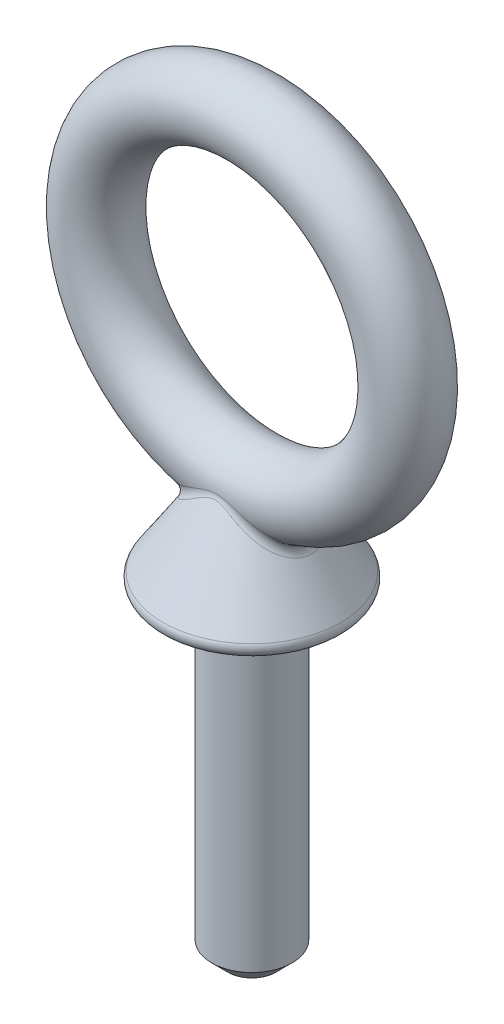
from build123d import *
from build123d.topology import SkipClean

# Parameters (mm, degrees)
BOSS_EXTRUDE1_START = -19.84375
SKETCH2_R           = 3.175
BOSS_EXTRUDE1_DEPTH = 25.4
SKETCH6_R           = 2.778125
SKETCH7_R           = 3.175
BOSS_EXTRUDE2_DEPTH = 4.7625
FILLET1_R           = 0.69453125
CHAMFER1_SIZE       = 1.27


with BuildPart() as part:
    # Sketch2 → Boss-Extrude1 (new body)
    with BuildSketch(Plane(origin=(0, 0, 0), x_dir=(1, 0, 0), z_dir=(0, 1, 0)).offset(BOSS_EXTRUDE1_START)):
        with Locations(Location((0, 0, 0), (0, 0, 270))):
            Circle(SKETCH2_R)
    extrude(amount=-BOSS_EXTRUDE1_DEPTH)

    # Sketch7 → Boss-Extrude2 (add)
    with BuildSketch(Plane(origin=(0, -19.84375, 0), x_dir=(1, 0, 0), z_dir=(0, 1, 0))):
        with Locations(Location((0, 0, 0), (0, 0, 270))):
            Circle(SKETCH7_R)
    extrude(amount=BOSS_EXTRUDE2_DEPTH)



with BuildPart() as body_2:
    # Sketch6 → Revolve1 (revolve)
    with BuildSketch(Plane(origin=(0, 0, 0), x_dir=(0, 0, -1), z_dir=(1, 0, 0)), mode=Mode.PRIVATE) as revolve1_sk:
        with Locations((0, 12.303125)):
            Circle(SKETCH6_R)
    revolve(revolve1_sk.sketch.rotate(Axis((0, 0, -7.858125), (0, 0, 1)), 90), axis=Axis((0, 0, -7.858125), (0, 0, 1)))


with BuildPart() as part_1:
    with SkipClean():  # the faces are left unmerged after this step: merging them gives an invalid solid
        add(part.part)

        add(body_2.part)  # Revolve2 merges body 2
        # Sketch8 → Revolve2 (revolve)
        with BuildSketch(Plane.XY, mode=Mode.PRIVATE) as revolve2_sk:
            with BuildLine():
                Line((0, -19.84375), (0, -12.303125))
                Line((0, -12.303125), (-2.778125, -12.303125))
                Line((-2.778125, -12.303125), (-7.029506171, -18.767590441))
                ThreePointArc((-7.029506171, -18.767590441), (-7.060539633, -19.478855573), (-6.44921875, -19.84375))
                Line((-6.44921875, -19.84375), (0, -19.84375))
            make_face()
        revolve(revolve2_sk.sketch.rotate(Axis((0, -19.84375, 0), (0, 1, 0)), 270), axis=Axis((0, -19.84375, 0), (0, 1, 0)))

    # Fillet1
    fillet1_edges = [part_1.edges().sort_by_distance(p)[0] for p in [
        (4.210740224, -14.481497448, 6.6e-08),
    ]]
    fillet(fillet1_edges, radius=FILLET1_R)

    # Chamfer1
    chamfer1_edges = [part_1.edges().sort_by_distance(p)[0] for p in [
        (0, -45.24375, -3.175),
    ]]
    chamfer(chamfer1_edges, length=CHAMFER1_SIZE)


solid = part_1.part
